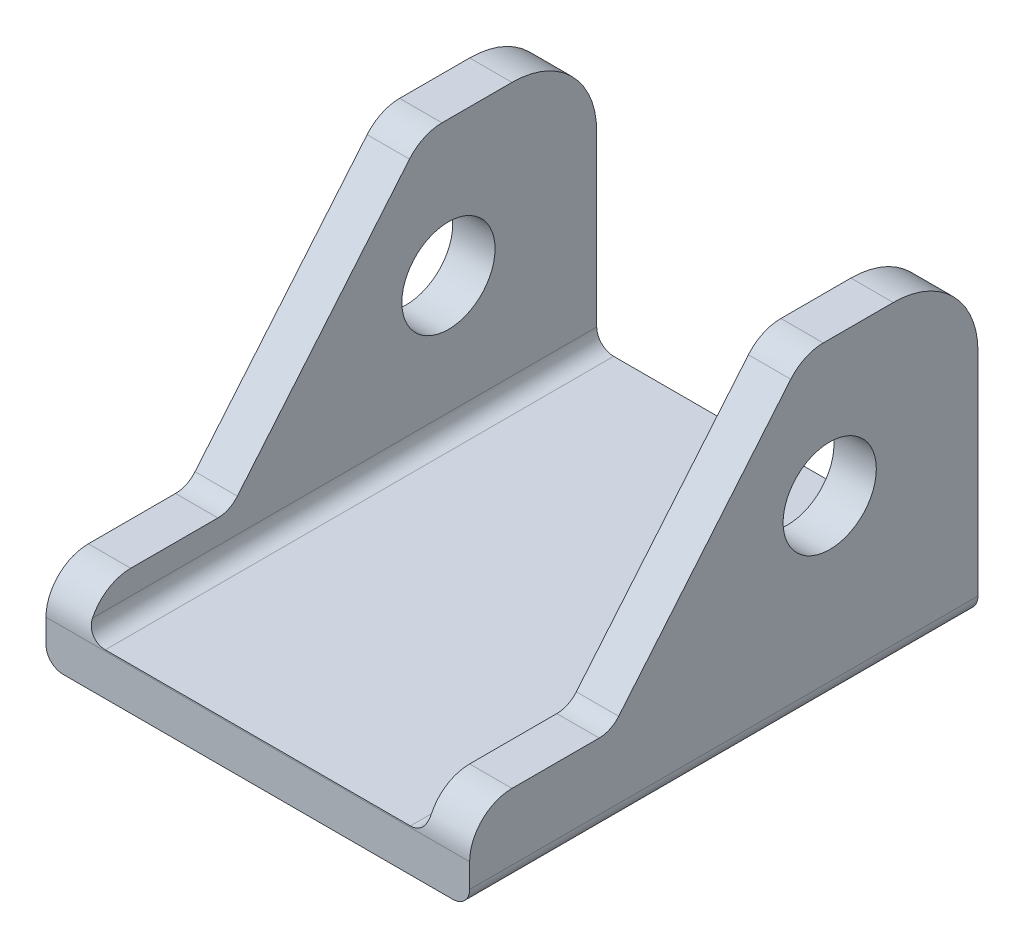
from build123d import *

# Parameters (mm, degrees)
BOSS_EXTRUDE1_DEPTH     = 60
M10_CLEARANCE_SLOT2_D   = 11
FILLET3_R               = 10
FILLET4_R               = 10
FILLET5_R               = 10
FILLET6_R               = 10
CUT_EXTRUDE7_DEPTH      = 662.462886094
CUT_EXTRUDE7_DEPTH_BACK = 662.462886094


with BuildPart() as part:
    # Sketch1 → Boss-Extrude1 (new body)
    with BuildSketch(Plane.XY):
        with BuildLine():
            Line((-86.925191049, -8.248133662), (-50.925191049, -8.248133662))
            ThreePointArc((-50.925191049, -8.248133662), (-49.510977486, -7.662347225), (-48.925191049, -6.248133662))
            Line((-48.925191049, -6.248133662), (-48.925191049, 23.751866338))
            Line((-48.925191049, 23.751866338), (-43.925191049, 23.751866338))
            Line((-43.925191049, 23.751866338), (-43.925191049, -11.248133662))
            ThreePointArc((-43.925191049, -11.248133662), (-44.510977486, -12.662347225), (-45.925191049, -13.248133662))
            Line((-45.925191049, -13.248133662), (-91.925191049, -13.248133662))
            ThreePointArc((-91.925191049, -13.248133662), (-93.339404611, -12.662347225), (-93.925191049, -11.248133662))
            Line((-93.925191049, -11.248133662), (-93.925191049, 23.751866338))
            Line((-93.925191049, 23.751866338), (-88.925191049, 23.751866338))
            Line((-88.925191049, 23.751866338), (-88.925191049, -6.248133662))
            ThreePointArc((-88.925191049, -6.248133662), (-88.339404611, -7.662347225), (-86.925191049, -8.248133662))
        make_face()
    extrude(amount=BOSS_EXTRUDE1_DEPTH)

    # M10 Clearance Slot2 (through all)
    with Locations(Plane(origin=(-43.925191049, 0, 0), x_dir=(0, 0, -1), z_dir=(1, 0, 0))):
        with Locations((-17.5, 7.751866338)):
            Hole(M10_CLEARANCE_SLOT2_D / 2)

    # Fillet3
    fillet3_edges = [part.edges().sort_by_distance(p)[0] for p in [
        (-46.425191049, 23.751866338, 0),
    ]]
    fillet(fillet3_edges, radius=FILLET3_R)

    # Fillet4
    fillet4_edges = [part.edges().sort_by_distance(p)[0] for p in [
        (-91.425191049, 23.751866338, 0),
    ]]
    fillet(fillet4_edges, radius=FILLET4_R)

    # Fillet5
    fillet5_edges = [part.edges().sort_by_distance(p)[0] for p in [
        (-91.425191049, 23.751866338, 60),
    ]]
    fillet(fillet5_edges, radius=FILLET5_R)

    # Fillet6
    fillet6_edges = [part.edges().sort_by_distance(p)[0] for p in [
        (-46.425191049, 23.751866338, 60),
    ]]
    fillet(fillet6_edges, radius=FILLET6_R)

    # Sketch14 → Cut-Extrude7 (cut, two sides: drawn at the far end of the back side and taken through both)
    with BuildSketch(Plane(origin=(-93.925191049, 454.839375965, 464.679710135), x_dir=(0, 1, 0), z_dir=(-1, 0, 0)).offset(-CUT_EXTRUDE7_DEPTH_BACK)):
        with BuildLine():
            Line((-431.087509627, 603.604150029), (-431.087509627, 454.679710135))
            Line((-431.087509627, 454.679710135), (-431.087509627, 446.415843646))
            ThreePointArc((-431.087509627, 446.415843646), (-431.55780963, 444.298813194), (-432.8802368, 442.580038514))
            Line((-432.8802368, 442.580038514), (-457.173377588, 422.26755452))
            ThreePointArc((-457.173377588, 422.26755452), (-457.96683389, 421.236289712), (-458.249013892, 419.966071441))
            Line((-458.249013892, 419.966071441), (-458.249013892, 409.679710135))
            ThreePointArc((-458.249013892, 409.679710135), (-459.713479986, 406.144176229), (-463.249013892, 404.679710135))
            Line((-463.249013892, 404.679710135), (-466.087509627, 404.679710135))
            Line((-466.087509627, 404.679710135), (-615.011949522, 404.679710135))
            Line((-615.011949522, 404.679710135), (-396.317051305, 202.475613526))
            Line((-396.317051305, 202.475613526), (-212.39261141, 401.40005342))
            Line((-212.39261141, 401.40005342), (-431.087509627, 603.604150029))
        make_face()
    extrude(amount=CUT_EXTRUDE7_DEPTH + CUT_EXTRUDE7_DEPTH_BACK, mode=Mode.SUBTRACT)


solid = part.part
